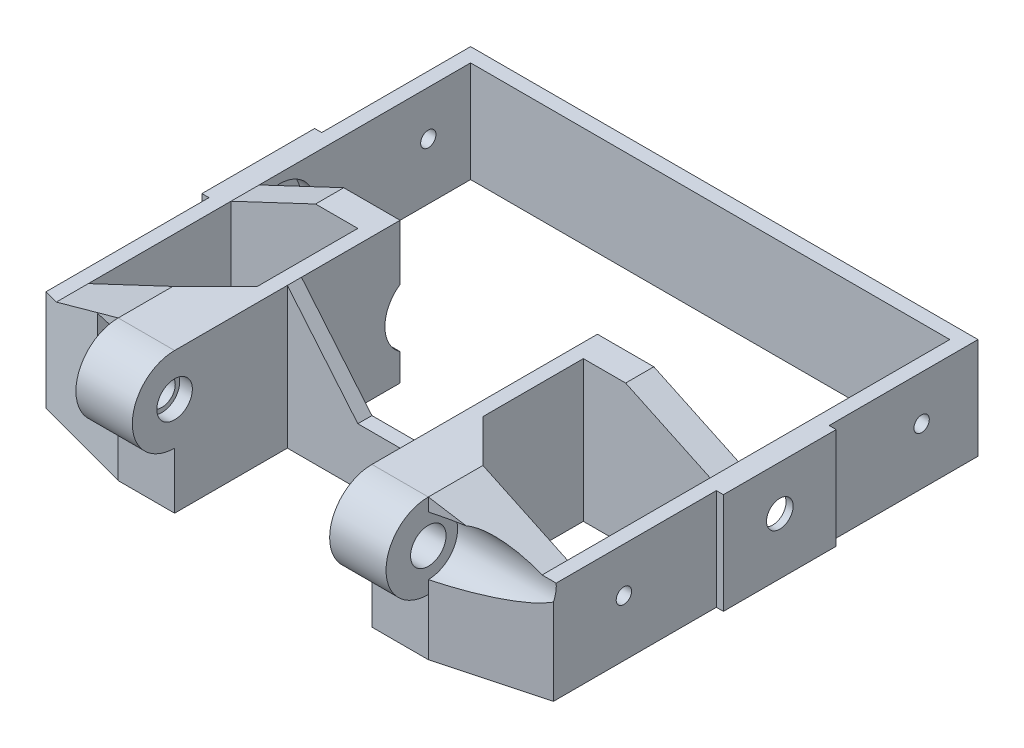
from build123d import *

# Parameters (mm, degrees)
SKETCH1_W                = 12.7
SKETCH1_H                = 9.525
BOSS_EXTRUDE1_DEPTH      = 9.525
BOSS_EXTRUDE1_DEPTH_BACK = 22.225
SKETCH2_W                = 28.575
SKETCH2_H                = 32.144829198
CUT_EXTRUDE1_DEPTH       = 127.92060018
CUT_EXTRUDE1_DEPTH_BACK  = 127.92060018
CHAMFER1_SIZE            = 9.525
SKETCH11_W               = 143.179068554
SKETCH11_H               = 12.488767135
CUT_EXTRUDE5_DEPTH       = 119.773497618
SKETCH5_W                = 9.85
SKETCH5_H                = 3
SKETCH5_W_2              = 60
SKETCH5_H_2              = 4
CUT_EXTRUDE3_REACH       = 156.535
SKETCH6_R                = 1.7272
SKETCH6_R_2              = 8
SKETCH7_W                = 25.4
SKETCH7_H                = 22.769743879
BOSS_EXTRUDE2_DEPTH      = 1.5875
CUT_EXTRUDE4_REACH       = 157.713
SKETCH8_R                = 3
CUT_EXTRUDE6_DEPTH       = 99.74454178
CUT_EXTRUDE6_DEPTH_BACK  = 12.7


with BuildPart() as part:
    # Sketch1 → Revolve1 (revolve)
    with BuildSketch(Plane.XY, mode=Mode.PRIVATE) as revolve1_sk:
        with Locations((-28.575, 4.7625)):
            Rectangle(SKETCH1_W, SKETCH1_H)
        with Locations((28.575, 4.7625)):
            Rectangle(SKETCH1_W, SKETCH1_H)
    revolve(revolve1_sk.sketch.rotate(Axis((-22.225, 0, 0), (1, 0, 0)), 90), axis=Axis((-22.225, 0, 0), (1, 0, 0)))

    # Sketch2 → Boss-Extrude1 (add, two sides: drawn at the far end of the back side and taken through both)
    with BuildSketch(Plane(origin=(0, 0, 0), x_dir=(1, 0, 0), z_dir=(0, 1, 0)).offset(-BOSS_EXTRUDE1_DEPTH_BACK)):
        Polygon((-57.15, 5.955170802), (-34.925, 0), (-22.225, 0), (-22.225, 25.4), (22.225, 25.4), (22.225, 0), (34.925, 0), (57.15, 5.955170802), (57.15, 101.6), (-57.15, 101.6), align=None)
        Polygon((-22.225, 28.575), (-22.225, 50.8), (-53.975, 50.8), (-53.975, 98.425), (53.975, 98.425), (53.975, 50.8), (22.225, 50.8), (22.225, 28.575), align=None, mode=Mode.SUBTRACT)
        with Locations((39.6875, 28.377585401)):
            Rectangle(SKETCH2_W, SKETCH2_H, mode=Mode.SUBTRACT)
        with Locations((-39.6875, 28.377585401)):
            Rectangle(SKETCH2_W, SKETCH2_H, mode=Mode.SUBTRACT)
    extrude(amount=BOSS_EXTRUDE1_DEPTH + BOSS_EXTRUDE1_DEPTH_BACK)

    # Sketch3 → Cut-Extrude1 (cut, two sides: drawn at the far end of the back side and taken through both)
    with BuildSketch(Plane(origin=(0, 0, -101.6), x_dir=(-1, 0, 0), z_dir=(0, 0, -1)).offset(-CUT_EXTRUDE1_DEPTH_BACK)):
        Polygon((-363.181758486, 0.544743879), (-78.360804047, 0.544743879), (-53.975, 0.544743879), (-34.925, 9.525), (34.925, 9.525), (53.975, 0.544743879), (73.137213101, 0.544743879), (357.958167541, 0.544743879), (357.958167541, 570.186652758), (-363.181758486, 570.186652758), align=None)
    extrude(amount=CUT_EXTRUDE1_DEPTH + CUT_EXTRUDE1_DEPTH_BACK, mode=Mode.SUBTRACT)

    # Chamfer1
    chamfer1_edges = [part.edges().sort_by_distance(p)[0] for p in [
        (-25.4, -6.35, -12.305170802),
        (25.4, -6.35, -12.305170802),
    ]]
    chamfer(chamfer1_edges, length=CHAMFER1_SIZE)

    # Sketch11 → Cut-Extrude5 (cut, through all)
    with BuildSketch(Plane(origin=(0, 0.544743879, 0), x_dir=(1, 0, 0), z_dir=(0, 1, 0))):
        with Locations((14.439534277, 95.355616432)):
            Rectangle(SKETCH11_W, SKETCH11_H)
    extrude(amount=CUT_EXTRUDE5_DEPTH, mode=Mode.SUBTRACT)

    # Sketch5 → Cut-Revolve1 (revolve, cut)
    with BuildSketch(Plane(origin=(0, 0, 0), x_dir=(1, 0, 0), z_dir=(0, 1, 0)), mode=Mode.PRIVATE) as cut_revolve1_sk:
        Polygon((-34.925, -3), (-34.925, 0), (-41.275, 0), (-41.275, -6.604), (-34.925, -6.604), align=None)
        with Locations((-30, -1.5)):
            Rectangle(SKETCH5_W, SKETCH5_H)
        Polygon((73.349668225, 0), (34.925, 0), (34.925, -4), (34.925, -6.604), (73.349668225, -6.604), align=None)
        with Locations((4.925, -2)):
            Rectangle(SKETCH5_W_2, SKETCH5_H_2)
    revolve(cut_revolve1_sk.sketch.rotate(Axis((116.428907087, 0, 0), (-1, 0, 0)), 180), axis=Axis((116.428907087, 0, 0), (-1, 0, 0)), mode=Mode.SUBTRACT)

    # Sketch6 → Cut-Extrude3 (cut, up to next)
    with BuildSketch(Plane.ZY.offset(57.15), mode=Mode.PRIVATE) as cut_extrude3_sk1:
        with Locations((-88.9, -9.525)):
            Circle(SKETCH6_R)
    cut_extrude3_tool1 = extrude(cut_extrude3_sk1.sketch, amount=-CUT_EXTRUDE3_REACH, mode=Mode.PRIVATE) & part.part
    # Sketch6 → Cut-Extrude3 (cut, up to next)
    with BuildSketch(Plane.ZY.offset(57.15), mode=Mode.PRIVATE) as cut_extrude3_sk2:
        with Locations((-21.830170802, -9.525)):
            Circle(SKETCH6_R)
    cut_extrude3_tool2 = extrude(cut_extrude3_sk2.sketch, amount=-CUT_EXTRUDE3_REACH, mode=Mode.PRIVATE) & part.part
    # Sketch6 → Cut-Extrude3 (cut, up to next)
    with BuildSketch(Plane.ZY.offset(57.15), mode=Mode.PRIVATE) as cut_extrude3_sk3:
        with Locations((-55.365085401, -9.525)):
            Circle(SKETCH6_R_2)
    cut_extrude3_tool3 = extrude(cut_extrude3_sk3.sketch, amount=-CUT_EXTRUDE3_REACH, mode=Mode.PRIVATE) & part.part
    cut_extrude3_1 = cut_extrude3_tool1.solids().sort_by_distance((-57.15, -9.525, -88.9))[0]
    add(cut_extrude3_1, mode=Mode.SUBTRACT)
    cut_extrude3_2 = cut_extrude3_tool2.solids().sort_by_distance((-57.15, -9.525, -21.830171))[0]
    add(cut_extrude3_2, mode=Mode.SUBTRACT)
    cut_extrude3_3 = cut_extrude3_tool3.solids().sort_by_distance((-57.15, -9.525, -55.365085))[0]
    add(cut_extrude3_3, mode=Mode.SUBTRACT)
    cut_extrude3 = cut_extrude3_1 + cut_extrude3_2 + cut_extrude3_3  # Cut-Extrude3 as one shape, for the pattern or mirror that repeats it

    # Sketch7 → Boss-Extrude2 (add)
    with BuildSketch(Plane.ZY.offset(57.15)):
        with Locations((-55.365085401, -10.840128061)):
            Rectangle(SKETCH7_W, SKETCH7_H)
    boss_extrude2 = extrude(amount=BOSS_EXTRUDE2_DEPTH)

    # Sketch8 → Cut-Extrude4 (cut, up to next)
    with BuildSketch(Plane.ZY.offset(58.7375), mode=Mode.PRIVATE) as cut_extrude4_sk1:
        with Locations((-55.365085401, -9.525)):
            Circle(SKETCH8_R)
    cut_extrude4_tool1 = extrude(cut_extrude4_sk1.sketch, amount=-CUT_EXTRUDE4_REACH, mode=Mode.PRIVATE) & part.part
    cut_extrude4 = cut_extrude4_tool1.solids().sort_by_distance((-58.7375, -9.525, -55.365085))[0]
    add(cut_extrude4, mode=Mode.SUBTRACT)

    # Mirror1: Cut-Extrude3, Boss-Extrude2, Cut-Extrude4 across plane
    add(cut_extrude3.mirror(Plane(origin=(0, 0, 0), x_dir=(0, 0, 1), z_dir=(1, 0, 0))), mode=Mode.SUBTRACT)
    add(boss_extrude2.mirror(Plane(origin=(0, 0, 0), x_dir=(0, 0, 1), z_dir=(1, 0, 0))))
    add(cut_extrude4.mirror(Plane(origin=(0, 0, 0), x_dir=(0, 0, 1), z_dir=(1, 0, 0))), mode=Mode.SUBTRACT)

    # Sketch12 → Cut-Extrude6 (cut, two sides: drawn at the far end of the back side and taken through both)
    with BuildSketch(Plane.XY.offset(-25.4).offset(-CUT_EXTRUDE6_DEPTH_BACK)):
        Polygon((-139.974688472, 150.824626166), (-22.225, 9.525), (-6.35, -9.525), (6.35, -9.525), (22.225, 9.525), (139.974688472, 150.824626166), (139.974688472, 518.686412656), (-139.974688472, 518.686412656), align=None)
    extrude(amount=CUT_EXTRUDE6_DEPTH + CUT_EXTRUDE6_DEPTH_BACK, mode=Mode.SUBTRACT)


solid = part.part
